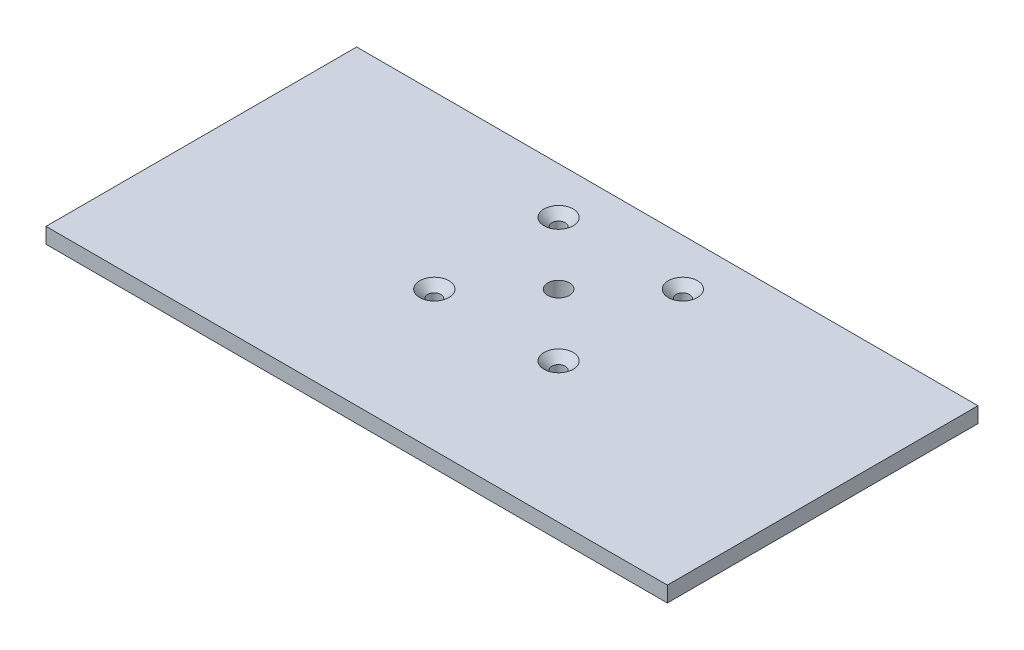
from build123d import *

# Parameters (mm, degrees)
SKETCH1_W                                       = 200
SKETCH1_H                                       = 100
BOSS_EXTRUDE1_DEPTH                             = 5
CSK_FOR_M4_FLAT_HEAD_MACHINE_SCREW1_D           = 4.3
CSK_FOR_M4_FLAT_HEAD_MACHINE_SCREW1_DEPTH       = 6
CSK_FOR_M4_FLAT_HEAD_MACHINE_SCREW1_CSINK_D     = 9.4
CSK_FOR_M4_FLAT_HEAD_MACHINE_SCREW1_CSINK_ANGLE = 90
CSK_FOR_M4_FLAT_HEAD_MACHINE_SCREW1_TIP         = 1.291850331
SKETCH2_R                                       = 3.5
CUT_EXTRUDE1_DEPTH                              = 5


with BuildPart() as part:
    # Sketch1 → Boss-Extrude1 (new body)
    with BuildSketch(Plane(origin=(0, 0, 0), x_dir=(1, 0, 0), z_dir=(0, 1, 0))):
        with Locations((-33.195876289, 1.134020619)):
            Rectangle(SKETCH1_W, SKETCH1_H)
    extrude(amount=BOSS_EXTRUDE1_DEPTH)

    # CSK for M4 Flat Head Machine Screw1
    with Locations(Plane(origin=(-53.195876289, 5, -36.134020619), x_dir=(0, 0, 1), z_dir=(0, 1, 0))):
        with Locations((0, 0), (0, 40), (40, 40), (40, 0)):
            CounterSinkHole(CSK_FOR_M4_FLAT_HEAD_MACHINE_SCREW1_D / 2, CSK_FOR_M4_FLAT_HEAD_MACHINE_SCREW1_CSINK_D / 2, depth=CSK_FOR_M4_FLAT_HEAD_MACHINE_SCREW1_DEPTH, counter_sink_angle=CSK_FOR_M4_FLAT_HEAD_MACHINE_SCREW1_CSINK_ANGLE)
            with Locations((0, 0, -(CSK_FOR_M4_FLAT_HEAD_MACHINE_SCREW1_DEPTH + CSK_FOR_M4_FLAT_HEAD_MACHINE_SCREW1_TIP / 2))):  # 118° drill point
                Cone(0, CSK_FOR_M4_FLAT_HEAD_MACHINE_SCREW1_D / 2, CSK_FOR_M4_FLAT_HEAD_MACHINE_SCREW1_TIP, mode=Mode.SUBTRACT)

    # Sketch2 → Cut-Extrude1 (cut)
    with BuildSketch(Plane(origin=(0, 5, 0), x_dir=(1, 0, 0), z_dir=(0, 1, 0))):
        with Locations(Location((-33.195876289, 16.134020619, 0), (0, 0, 270))):
            Circle(SKETCH2_R)
    extrude(amount=-CUT_EXTRUDE1_DEPTH, mode=Mode.SUBTRACT)


solid = part.part
